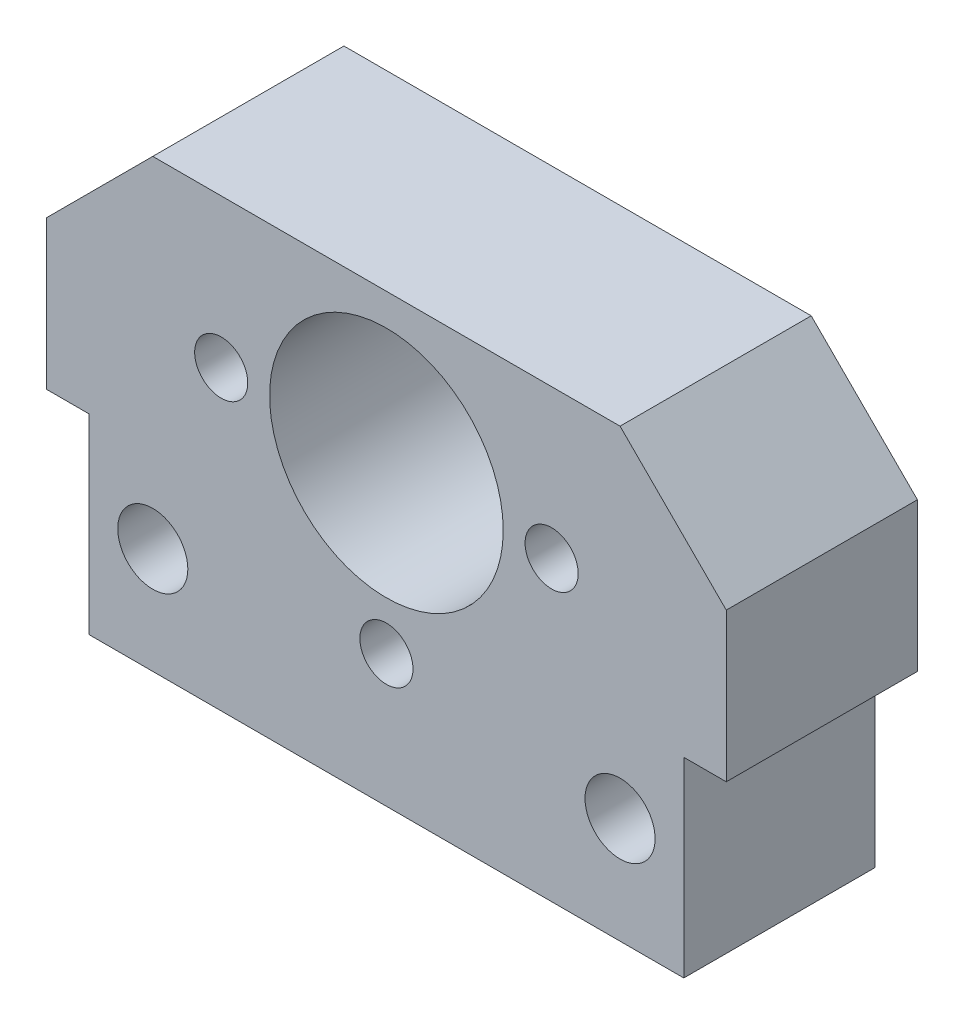
from build123d import *

# Parameters (mm, degrees)
ESQUISSE1_W             = 32
ESQUISSE1_H             = 19
BOSS_EXTRU_1_DEPTH      = 9
ESQUISSE2_R             = 5.5
ESQUISSE2_R_2           = 1.25
ESQUISSE2_R_3           = 1.65
ENL_V_MAT_EXTRU_1_DEPTH = 39.288379438
ESQUISSE3_W             = 2
ESQUISSE3_H             = 7
ENL_V_MAT_EXTRU_2_DEPTH = 39.288379438
ESQUISSE4_W             = 28
ESQUISSE4_H             = 2
BOSS_EXTRU_2_DEPTH      = 9
CHANFREIN1_SIZE         = 5


with BuildPart() as part:
    # Esquisse1 → Boss.-Extru.1 (new body)
    with BuildSketch(Plane.XY):
        with Locations((16, 9.5)):
            Rectangle(ESQUISSE1_W, ESQUISSE1_H)
    extrude(amount=BOSS_EXTRU_1_DEPTH)

    # Esquisse2 → Enlèv. mat.-Extru.1 (cut, through all)
    with BuildSketch(Plane.XY.offset(9)):
        with Locations((16, 12)):
            Circle(ESQUISSE2_R)
        with Locations((8.221825407, 12)):
            Circle(ESQUISSE2_R_2)
        with Locations(Location((23.778174593, 12, 0), (0, 0, 180))):
            Circle(ESQUISSE2_R_2)
        with Locations((16, 4.221825407)):
            Circle(ESQUISSE2_R_2)
        with Locations((5, 3)):
            Circle(ESQUISSE2_R_3)
        with Locations(Location((27, 3, 0), (0, 0, 180))):
            Circle(ESQUISSE2_R_3)
    extrude(amount=-ENL_V_MAT_EXTRU_1_DEPTH, mode=Mode.SUBTRACT)

    # Esquisse3 → Enlèv. mat.-Extru.2 (cut, through all)
    with BuildSketch(Plane.XY.offset(9)):
        with Locations((1, 3.5)):
            Rectangle(ESQUISSE3_W, ESQUISSE3_H)
        with Locations((31, 3.5)):
            Rectangle(ESQUISSE3_W, ESQUISSE3_H)
    extrude(amount=-ENL_V_MAT_EXTRU_2_DEPTH, mode=Mode.SUBTRACT)

    # Esquisse4 → Boss.-Extru.2 (add)
    with BuildSketch(Plane.XY.offset(9)):
        with Locations((16, -1)):
            Rectangle(ESQUISSE4_W, ESQUISSE4_H)
    extrude(amount=-BOSS_EXTRU_2_DEPTH)

    # Chanfrein1
    chanfrein1_edges = [part.edges().sort_by_distance(p)[0] for p in [
        (0, 19, 4.5),
        (32, 19, 4.5),
    ]]
    chamfer(chanfrein1_edges, length=CHANFREIN1_SIZE)


solid = part.part
